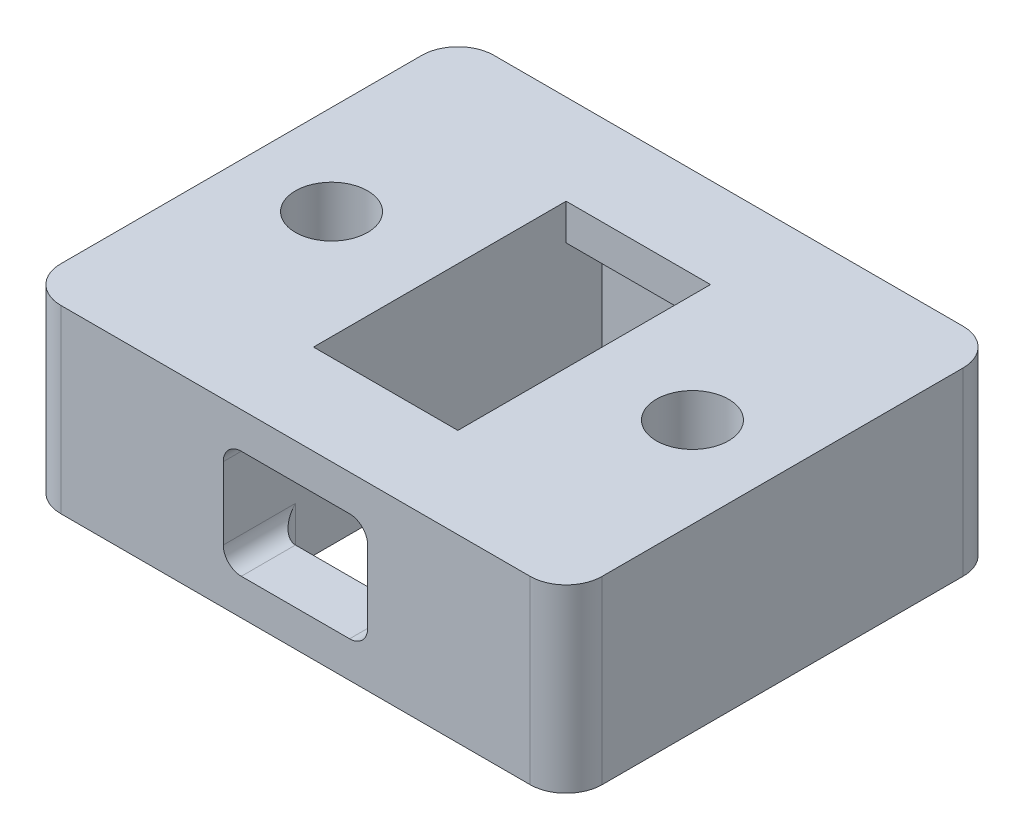
from build123d import *

# Parameters (mm, degrees)
SKETCH1_W           = 38.1
SKETCH1_H           = 30.48
SKETCH1_R           = 2.54
SKETCH1_W_2         = 10.16
SKETCH1_H_2         = 22.86
BOSS_EXTRUDE1_DEPTH = 12.7
SKETCH2_W           = 10.16
SKETCH2_H           = 2.54
BOSS_EXTRUDE2_DEPTH = 2.54
SKETCH3_W           = 10.16
SKETCH3_H           = 2.54
BOSS_EXTRUDE3_DEPTH = 2.54
FILLET1_R           = 2.54
SKETCH4_W           = 10.16
SKETCH4_H           = 7.62
CUT_EXTRUDE1_DEPTH  = 36.149415358
FILLET2_R           = 1.27


with BuildPart() as part:
    # Sketch1 → Boss-Extrude1 (new body)
    with BuildSketch(Plane(origin=(0, 0, 0), x_dir=(1, 0, 0), z_dir=(0, 1, 0))):
        Rectangle(SKETCH1_W, SKETCH1_H)
        with Locations(Location((12.7, 0, 0), (0, 0, 270))):
            Circle(SKETCH1_R, mode=Mode.SUBTRACT)
        with Locations(Location((-12.7, 0, 0), (0, 0, 270))):
            Circle(SKETCH1_R, mode=Mode.SUBTRACT)
        Rectangle(SKETCH1_W_2, SKETCH1_H_2, mode=Mode.SUBTRACT)
    extrude(amount=-BOSS_EXTRUDE1_DEPTH)

    # Sketch2 → Boss-Extrude2 (add)
    with BuildSketch(Plane.XY.offset(-11.43)):
        with Locations((0, -1.27)):
            Rectangle(SKETCH2_W, SKETCH2_H)
    extrude(amount=BOSS_EXTRUDE2_DEPTH)

    # Sketch3 → Boss-Extrude3 (add)
    with BuildSketch(Plane(origin=(0, 0, 11.43), x_dir=(-1, 0, 0), z_dir=(0, 0, -1))):
        with Locations((0, -1.27)):
            Rectangle(SKETCH3_W, SKETCH3_H)
    extrude(amount=BOSS_EXTRUDE3_DEPTH)

    # Fillet1
    fillet1_edges = [part.edges().sort_by_distance(p)[0] for p in [
        (19.05, -6.35, 15.24),
        (-19.05, -6.35, 15.24),
        (-19.05, -6.35, -15.24),
        (19.05, -6.35, -15.24),
    ]]
    fillet(fillet1_edges, radius=FILLET1_R)

    # Sketch4 → Cut-Extrude1 (cut, through all)
    with BuildSketch(Plane(origin=(0, 0, 11.43), x_dir=(-1, 0, 0), z_dir=(0, 0, -1))):
        with Locations((0, -6.35)):
            Rectangle(SKETCH4_W, SKETCH4_H)
    extrude(amount=-CUT_EXTRUDE1_DEPTH, mode=Mode.SUBTRACT)

    # Fillet2
    fillet2_edges = [part.edges().sort_by_distance(p)[0] for p in [
        (-5.08, -11.43, 11.43),
        (5.08, -11.43, 11.43),
        (-5.08, -2.54, 12.065),
        (5.08, -2.54, 12.065),
        (5.08, -10.16, 13.335),
        (-5.08, -10.16, 13.335),
    ]]
    fillet(fillet2_edges, radius=FILLET2_R)


solid = part.part
